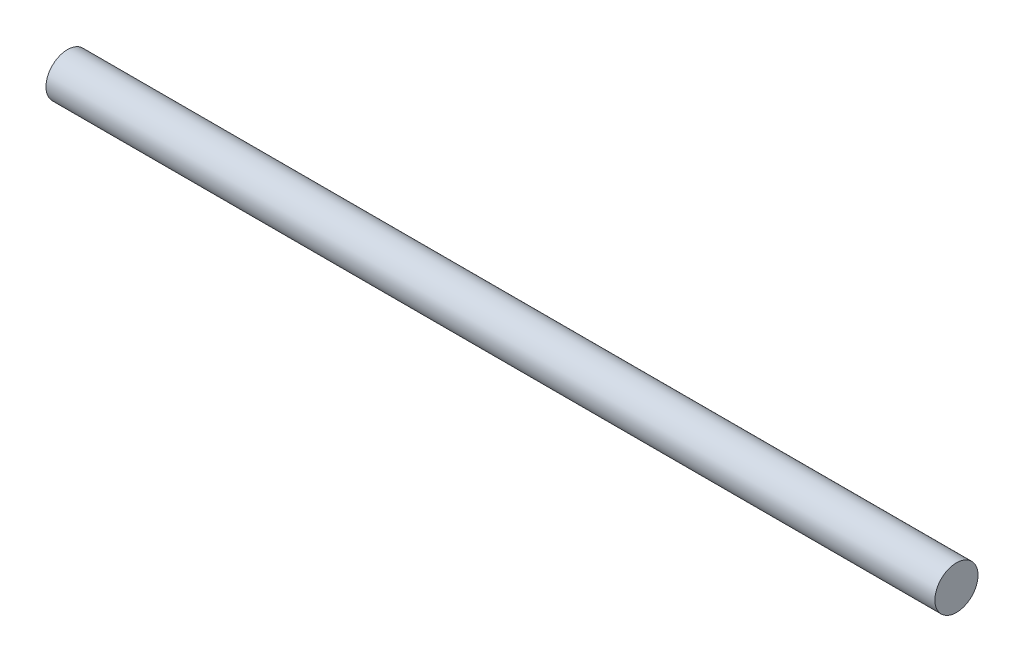
from build123d import *

# Parameters (mm, degrees)
SKETCH2_R           = 4
BOSS_EXTRUDE1_DEPTH = 82.5


with BuildPart() as part:
    # Sketch2 → Boss-Extrude1 (new, symmetric)
    with BuildSketch(Plane(origin=(0, 0, 0), x_dir=(0, 0, -1), z_dir=(1, 0, 0))):
        Circle(SKETCH2_R)
    extrude(amount=BOSS_EXTRUDE1_DEPTH, both=True)


solid = part.part
